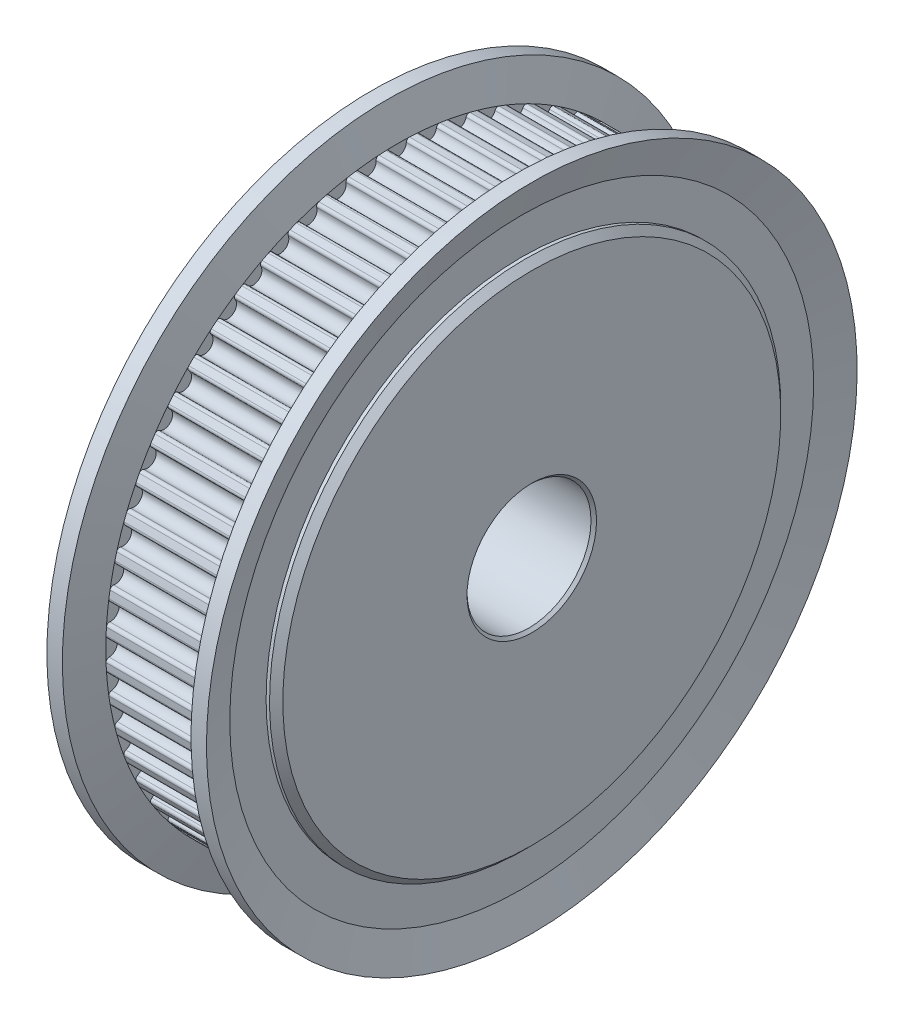
from build123d import *

# Parameters (mm, degrees)
CUT_EXTRUDE_START        = 8.65
CUT_EXTRUDE_1_DEPTH      = 7
PATTERN_CIRCULAR_1_COUNT = 60
SKETCH_6_R               = 4
CUT_EXTRUDE_2_DEPTH      = 32.433898899
CHAMFER_1_SIZE           = 0.18


with BuildPart() as part:
    # 草图3 → 旋转1 (revolve)
    with BuildSketch(Plane.XY):
        Polygon((0, 0), (0, 16.07), (0.43, 16.5), (1.65, 16.5), (1.65, 18.845), (8.65, 18.845), (8.65, 16.5), (9.87, 16.5), (10.3, 16.07), (10.3, 0), align=None)
    revolve(axis=Axis((10.3, 0, 0), (-1, 0, 0)))

    # 草图4 → 切除-拉伸1 (cut)
    with BuildSketch(Plane(origin=(0, 0, 0), x_dir=(0, 0, -1), z_dir=(1, 0, 0)).offset(CUT_EXTRUDE_START)):
        with BuildLine():
            ThreePointArc((0.757891715, 18.82975372), (0, 18.845), (-0.757891715, 18.82975372))
            ThreePointArc((-0.757891715, 18.82975372), (-0.61275747, 18.775538695), (-0.549888746, 18.633938053))
            ThreePointArc((-0.549888746, 18.633938053), (0, 18.095), (0.549888746, 18.633938053))
            ThreePointArc((0.549888746, 18.633938053), (0.61275747, 18.775538695), (0.757891715, 18.82975372))
        make_face()
    cut_extrude_1 = extrude(amount=-CUT_EXTRUDE_1_DEPTH, mode=Mode.SUBTRACT)

    # 阵列(圆周)1: 切除-拉伸1 ×60 about axis
    pattern_circular_1_axis = Axis((0, 0, 0), (1, 0, 0))
    for i in range(1, PATTERN_CIRCULAR_1_COUNT):
        add(cut_extrude_1.rotate(pattern_circular_1_axis, i * 360 / PATTERN_CIRCULAR_1_COUNT), mode=Mode.SUBTRACT)

    # 草图5 → 旋转2 (revolve)
    with BuildSketch(Plane.XY, mode=Mode.PRIVATE) as revolve_2_sk:
        Polygon((1, 21), (1.65, 18.845), (1.65, 16.5), (0.65, 16.5), (0.65, 18.845), (0, 21), align=None)
        Polygon((9.65, 16.5), (8.65, 16.5), (8.65, 18.845), (9.3, 21), (10.3, 21), (9.65, 18.845), align=None)
    revolve(revolve_2_sk.sketch.rotate(Axis((0, 0, 0), (1, 0, 0)), 180), axis=Axis((0, 0, 0), (1, 0, 0)))

    # 草图6 → 切除-拉伸2 (cut, through all)
    with BuildSketch(Plane(origin=(0, 0, 0), x_dir=(0, 0, -1), z_dir=(1, 0, 0))):
        Circle(SKETCH_6_R)
    extrude(amount=CUT_EXTRUDE_2_DEPTH, mode=Mode.SUBTRACT)

    # 倒角1
    chamfer_1_edges = [part.edges().sort_by_distance(p)[0] for p in [
        (0, 0, 4),
        (10.3, 0, 4),
    ]]
    chamfer(chamfer_1_edges, length=CHAMFER_1_SIZE)


solid = part.part
